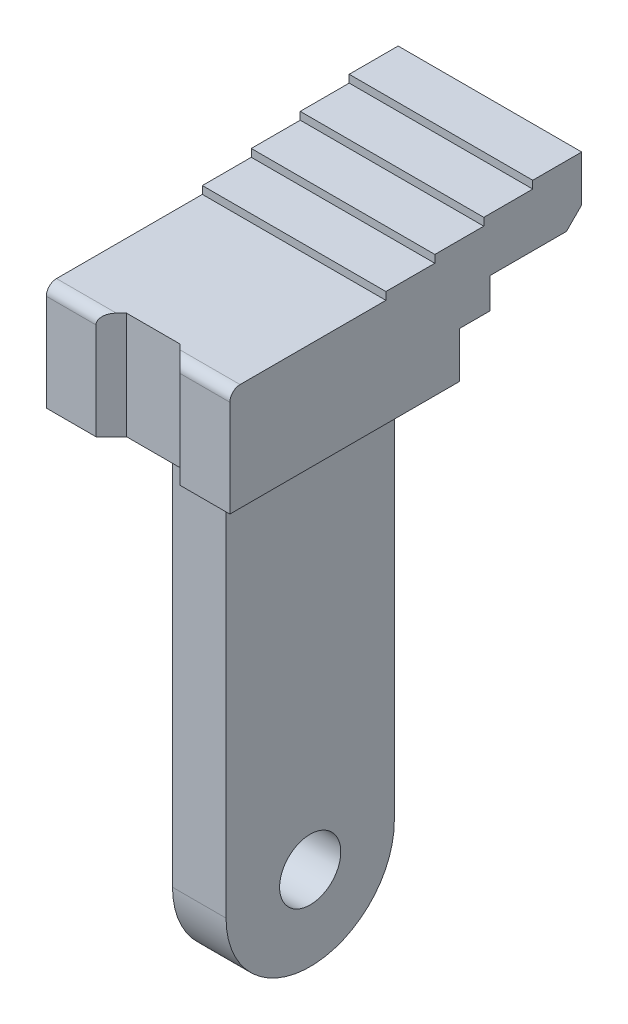
from build123d import *

# Parameters (mm, degrees)
SKETCH1_R           = 1
BOSS_EXTRUDE1_DEPTH = 3
SKETCH2_W           = 2.125
SKETCH2_H           = 16.25
CUT_EXTRUDE1_DEPTH  = 22.56965461
CUT_EXTRUDE2_DEPTH  = 3.5
FILLET1_R           = 0.333333333


with BuildPart() as part:
    # Sketch1 → Boss-Extrude1 (new, symmetric)
    with BuildSketch(Plane(origin=(0, 0, 0), x_dir=(0, 0, -1), z_dir=(1, 0, 0))):
        with BuildLine():
            Line((2.75, 0), (2.75, 15))
            Line((2.75, 15), (3.75, 15))
            Line((3.75, 15), (3.75, 16))
            Line((3.75, 16), (6.25, 16))
            Line((6.25, 16), (6.75, 16.5))
            Line((6.75, 16.5), (6.75, 18))
            Line((6.75, 18), (5.15, 18))
            Line((5.15, 18), (5.15, 17.75))
            Line((5.15, 17.75), (3.55, 17.75))
            Line((3.55, 17.75), (3.55, 17.5))
            Line((3.55, 17.5), (1.95, 17.5))
            Line((1.95, 17.5), (1.95, 17.25))
            Line((1.95, 17.25), (0.35, 17.25))
            Line((0.35, 17.25), (0.35, 17))
            Line((0.35, 17), (-4.75, 17))
            Line((-4.75, 17), (-4.75, 13.5))
            Line((-4.75, 13.5), (-2.75, 13.5))
            Line((-2.75, 13.5), (-2.75, 0))
            ThreePointArc((-2.75, 0), (0, -2.75), (2.75, 0))
        make_face()
        Circle(SKETCH1_R, mode=Mode.SUBTRACT)
    extrude(amount=BOSS_EXTRUDE1_DEPTH, both=True)

    # Sketch2 → Cut-Extrude1 (cut, through all)
    with BuildSketch(Plane.XY.offset(4.75)):
        with Locations((1.9375, 5.375)):
            Rectangle(SKETCH2_W, SKETCH2_H)
        with Locations((-1.9375, 5.375)):
            Rectangle(SKETCH2_W, SKETCH2_H)
    extrude(amount=-CUT_EXTRUDE1_DEPTH, mode=Mode.SUBTRACT)

    # Sketch3 → Cut-Extrude2 (cut)
    with BuildSketch(Plane(origin=(0, 17, 0), x_dir=(1, 0, 0), z_dir=(0, 1, 0))):
        Polygon((-0.875, -4.25), (0.875, -4.25), (1.375, -4.75), (-1.375, -4.75), align=None)
    extrude(amount=-CUT_EXTRUDE2_DEPTH, mode=Mode.SUBTRACT)

    # Fillet1
    fillet1_edges = [part.edges().sort_by_distance(p)[0] for p in [
        (-2.1875, 17, 4.75),
        (2.1875, 17, 4.75),
    ]]
    fillet(fillet1_edges, radius=FILLET1_R)


solid = part.part
